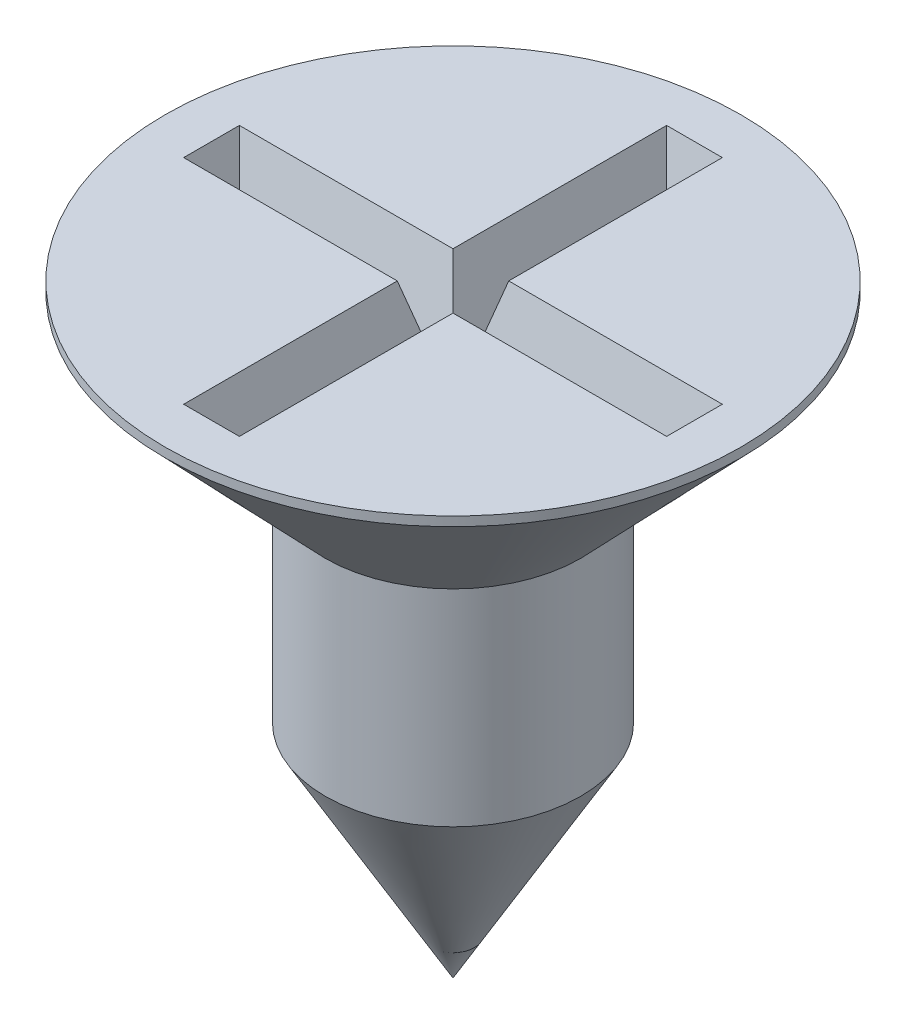
from build123d import *

# Parameters (mm, degrees)
CUT_EXTRUDE1_DEPTH = 1.9
CUT_EXTRUDE1_DRAFT = -15


with BuildPart() as part:
    # Sketch1 → Revolve1 (revolve)
    with BuildSketch(Plane.XY, mode=Mode.PRIVATE) as revolve1_sk:
        Polygon((0, 6.5), (6.2, 6.5), (6.2, 6.3), (2.75, 2.7), (2.75, -1.736860279), (0, -6.5), align=None)
    revolve(revolve1_sk.sketch.rotate(Axis((0, 6.5, 0), (0, -1, 0)), 90), axis=Axis((0, 6.5, 0), (0, -1, 0)))


with BuildPart() as cut_extrude1_tool:
    # Sketch2 → Cut-Extrude1 (with draft: the straight prism first)
    with BuildSketch(Plane(origin=(0, 6.5, 0), x_dir=(-1, 0, 0), z_dir=(0, 1, 0))):
        Polygon((-5.2, -0.6), (-0.6, -0.6), (-0.6, -5.2), (0.6, -5.2), (0.6, -0.6), (5.2, -0.6), (5.2, 0.6), (0.6, 0.6), (0.6, 5.2), (-0.6, 5.2), (-0.6, 0.6), (-5.2, 0.6), align=None)
    extrude(amount=-CUT_EXTRUDE1_DEPTH)
    # Cut-Extrude1: the draft: its side faces are tilted about the plane it starts from
    cut_extrude1_sides = [cut_extrude1_tool.faces().sort_by_distance(p)[0] for p in [
        (2.9, 5.55, -0.6),
        (0.6, 5.55, -2.9),
        (0, 5.55, -5.2),
        (-0.6, 5.55, -2.9),
        (-2.9, 5.55, -0.6),
        (-5.2, 5.55, 0),
        (-2.9, 5.55, 0.6),
        (-0.6, 5.55, 2.9),
        (0, 5.55, 5.2),
        (0.6, 5.55, 2.9),
        (2.9, 5.55, 0.6),
        (5.2, 5.55, 0),
    ]]
    draft(cut_extrude1_sides, Plane(origin=(0, 6.5, 0), x_dir=(-1, 0, 0), z_dir=(0, 1, 0)), CUT_EXTRUDE1_DRAFT)


with BuildPart() as part_1:
    add(part.part)

    # Cut-Extrude1: cut by cut_extrude1_tool
    add(cut_extrude1_tool.part, mode=Mode.SUBTRACT)


solid = part_1.part
